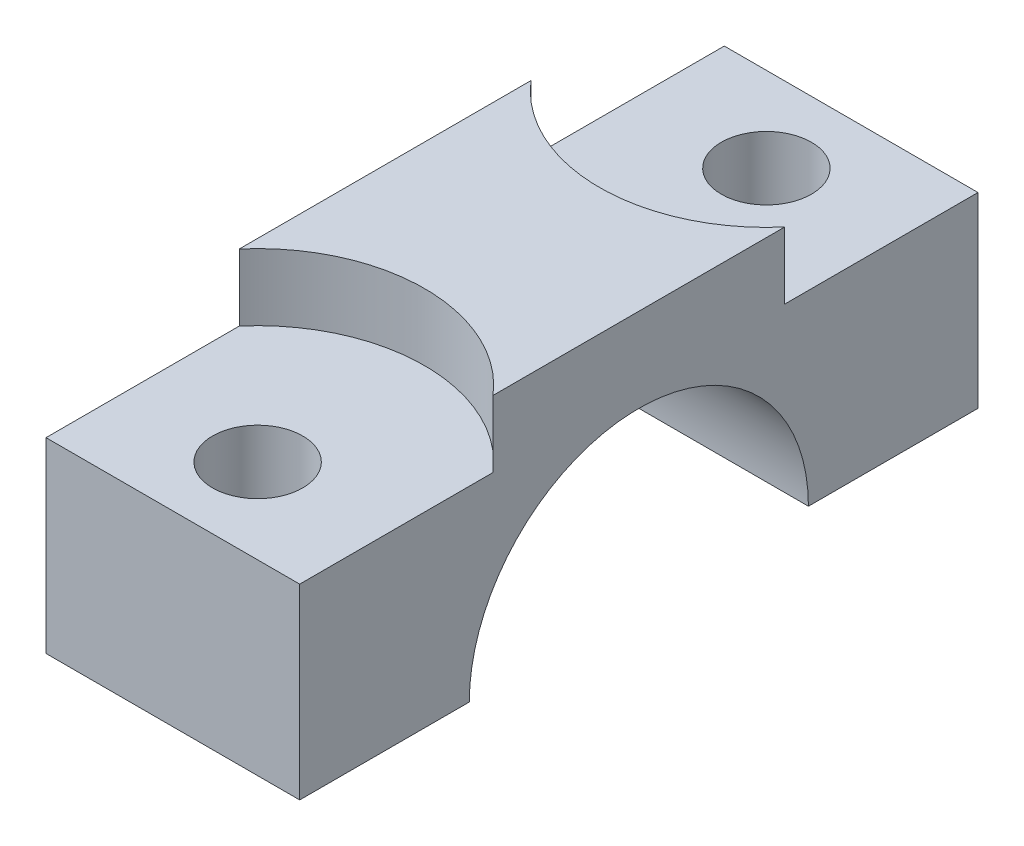
from build123d import *

# Parameters (mm, degrees)
BOSS_EXTRUDE1_DEPTH                           = 9.5
CBORE_FOR_M12_HEX_HEAD_CAP_SCREW1_D           = 6.75
CBORE_FOR_M12_HEX_HEAD_CAP_SCREW1_CBORE_D     = 25
CBORE_FOR_M12_HEX_HEAD_CAP_SCREW1_CBORE_DEPTH = 5


with BuildPart() as part:
    # Sketch2 → Boss-Extrude1 (new, symmetric)
    with BuildSketch(Plane(origin=(0, 0, 0), x_dir=(0, 0, -1), z_dir=(1, 0, 0))):
        with BuildLine():
            Line((12.7, 0), (25.4, 0))
            Line((25.4, 0), (25.4, 19))
            Line((25.4, 19), (-25.4, 19))
            Line((-25.4, 19), (-25.4, 0))
            Line((-25.4, 0), (-12.7, 0))
            ThreePointArc((-12.7, 0), (0, 12.7), (12.7, 0))
        make_face()
    extrude(amount=BOSS_EXTRUDE1_DEPTH, both=True)

    # CBORE for M12 Hex Head Cap Screw1 (through all)
    with Locations(Plane(origin=(0, 19, 0), x_dir=(1, 0, 0), z_dir=(0, 1, 0))):
        with Locations((0, 19.05), (0, -19.05)):
            CounterBoreHole(CBORE_FOR_M12_HEX_HEAD_CAP_SCREW1_D / 2, CBORE_FOR_M12_HEX_HEAD_CAP_SCREW1_CBORE_D / 2, CBORE_FOR_M12_HEX_HEAD_CAP_SCREW1_CBORE_DEPTH)


solid = part.part
